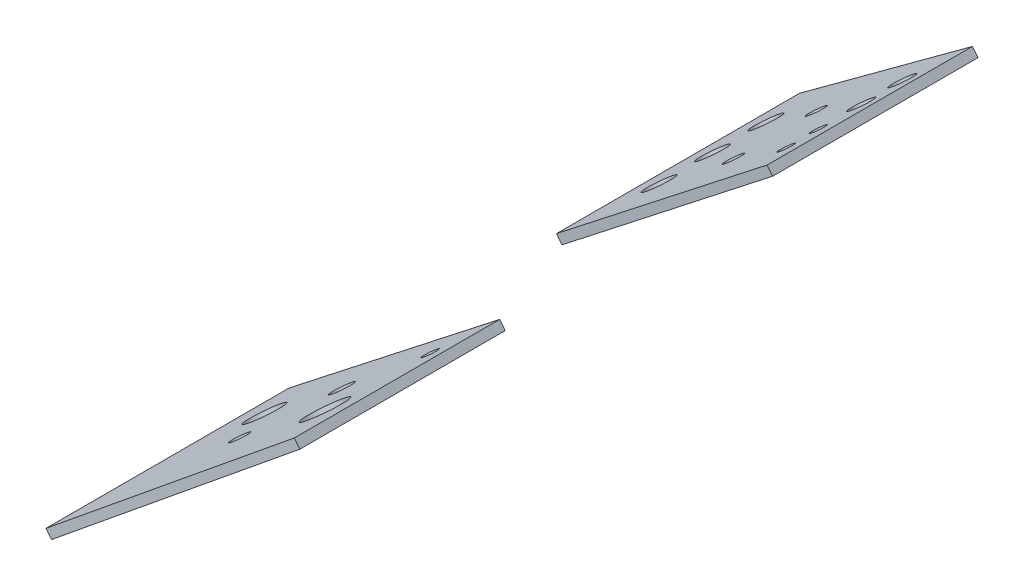
from build123d import *

# Parameters (mm, degrees)
BOSS_EXTRUDE1_START = -7.95
BOSS_EXTRUDE1_DEPTH = 2.5
SKETCH3_W           = 150
SKETCH3_H           = 150
CUT_EXTRUDE2_DEPTH  = 7.5
SKETCH4_R           = 6.5
CUT_EXTRUDE3_DEPTH  = 10
SKETCH5_R           = 4.1
CUT_EXTRUDE4_DEPTH  = 10
SKETCH6_R           = 5
CUT_EXTRUDE5_DEPTH  = 10
SKETCH7_R           = 8
CUT_EXTRUDE6_DEPTH  = 10
SKETCH8_R           = 4.1
SKETCH8_R_2         = 11.5
SKETCH8_R_3         = 5
CUT_EXTRUDE7_DEPTH  = 10
SKETCH9_R           = 10
CUT_EXTRUDE8_DEPTH  = 10
SKETCH10_R          = 6
CUT_EXTRUDE9_DEPTH  = 10


with BuildPart() as part:
    # Sketch2 → Boss-Extrude1 (new, symmetric)
    with BuildSketch(Plane(origin=(-22.996246438, 29.403869875, 0), x_dir=(-0.7877062019611437, -0.616051085050542, 0), z_dir=(0.6160510850505418, -0.7877062019611436, 0)).offset(BOSS_EXTRUDE1_START)):
        Polygon((-1011.422009658, 190.231808412), (-1011.422009658, -190.231808412), (-861.422009658, -211.354335393), (-861.422009658, 211.354335393), align=None)
    extrude(amount=BOSS_EXTRUDE1_DEPTH, both=True)

    # Sketch3 → Cut-Extrude2 (cut, symmetric)
    with BuildSketch(Plane(origin=(-29.433980277, 37.635399685, 0), x_dir=(0.787706201961144, 0.6160510850505414, 0), z_dir=(-0.6160510850505414, 0.787706201961144, 0))):
        with Locations((936.422009658, 0)):
            Rectangle(SKETCH3_W, SKETCH3_H)
    extrude(amount=CUT_EXTRUDE2_DEPTH, both=True, mode=Mode.SUBTRACT)


with BuildPart() as cut_extrude2_piece_1:
    # of the separate pieces the step leaves, piece 1, a body of its own (cut_extrude2_pieces)
    add(part.part.solids().sort_by_distance((770.349664956, 656.784495169, -190.231808412))[0])

    # Sketch4 → Cut-Extrude3 (cut)
    with BuildSketch(Plane(origin=(-29.433980277, 37.635399685, 0), x_dir=(0.787706201961144, 0.6160510850505414, 0), z_dir=(-0.6160510850505414, 0.787706201961144, 0))):
        with Locations(Location((993.417985757, 165.036346105, 0), (0, 0, 180))):
            Circle(SKETCH4_R)
        with Locations(Location((993.417985757, 142.036346105, 0), (0, 0, 180))):
            Circle(SKETCH4_R)
    extrude(amount=-CUT_EXTRUDE3_DEPTH, mode=Mode.SUBTRACT)

    # Sketch5 → Cut-Extrude4 (cut)
    with BuildSketch(Plane(origin=(-29.433980277, 37.635399685, 0), x_dir=(0.787706201961144, 0.6160510850505414, 0), z_dir=(-0.6160510850505414, 0.787706201961144, 0))):
        with Locations(Location((993.417985757, 117.842361568, 0), (0, 0, 180))):
            Circle(SKETCH5_R)
        with Locations(Location((993.417985757, 99.842361568, 0), (0, 0, 180))):
            Circle(SKETCH5_R)
    extrude(amount=-CUT_EXTRUDE4_DEPTH, mode=Mode.SUBTRACT)

    # Sketch6 → Cut-Extrude5 (cut)
    with BuildSketch(Plane(origin=(-29.433980277, 37.635399685, 0), x_dir=(0.787706201961144, 0.6160510850505414, 0), z_dir=(-0.6160510850505414, 0.787706201961144, 0))):
        with Locations(Location((938.52192437, 159.901373806, 0), (0, 0, 180))):
            Circle(SKETCH6_R)
        with Locations(Location((938.52192437, 113.501373806, 0), (0, 0, 180))):
            Circle(SKETCH6_R)
    extrude(amount=-CUT_EXTRUDE5_DEPTH, mode=Mode.SUBTRACT)

    # Sketch7 → Cut-Extrude6 (cut)
    with BuildSketch(Plane(origin=(-29.433980277, 37.635399685, 0), x_dir=(0.787706201961144, 0.6160510850505414, 0), z_dir=(-0.6160510850505414, 0.787706201961144, 0))):
        with Locations(Location((887.574329997, 171.938506111, 0), (0, 0, 180))):
            Circle(SKETCH7_R)
        with Locations(Location((887.574329997, 141.938506111, 0), (0, 0, 180))):
            Circle(SKETCH7_R)
        with Locations(Location((887.574329997, 111.938506111, 0), (0, 0, 180))):
            Circle(SKETCH7_R)
    extrude(amount=-CUT_EXTRUDE6_DEPTH, mode=Mode.SUBTRACT)


with BuildPart() as cut_extrude2_piece_2:
    # of the separate pieces the step leaves, piece 2, a body of its own (cut_extrude2_pieces)
    add(part.part.solids().sort_by_distance((767.269409531, 660.723026179, 75))[0])

    # Sketch8 → Cut-Extrude7 (cut)
    with BuildSketch(Plane(origin=(-29.433980277, 37.635399685, 0), x_dir=(0.787706201961144, 0.6160510850505414, 0), z_dir=(-0.6160510850505414, 0.787706201961144, 0))):
        with Locations(Location((993.417985757, -99.842361568, 0), (0, 0, 180))):
            Circle(SKETCH8_R)
        with Locations(Location((981.058254788, -149.148862314, 0), (0, 0, 180))):
            Circle(SKETCH8_R_2)
        with Locations(Location((920.329120361, -149.148862314, 0), (0, 0, 180))):
            Circle(SKETCH8_R_3)
    extrude(amount=-CUT_EXTRUDE7_DEPTH, mode=Mode.SUBTRACT)

    # Sketch9 → Cut-Extrude8 (cut)
    with BuildSketch(Plane(origin=(-29.433980277, 37.635399685, 0), x_dir=(0.787706201961144, 0.6160510850505414, 0), z_dir=(-0.6160510850505414, 0.787706201961144, 0))):
        with Locations(Location((893.323046846, -113.92353986, 0), (0, 0, 180))):
            Circle(SKETCH9_R)
    extrude(amount=-CUT_EXTRUDE8_DEPTH, mode=Mode.SUBTRACT)

    # Sketch10 → Cut-Extrude9 (cut)
    with BuildSketch(Plane(origin=(-29.433980277, 37.635399685, 0), x_dir=(0.787706201961144, 0.6160510850505414, 0), z_dir=(-0.6160510850505414, 0.787706201961144, 0))):
        with Locations(Location((948.323046846, -113.92353986, 0), (0, 0, 180))):
            Circle(SKETCH10_R)
    extrude(amount=-CUT_EXTRUDE9_DEPTH, mode=Mode.SUBTRACT)


solid = Compound([cut_extrude2_piece_1.part, cut_extrude2_piece_2.part])
